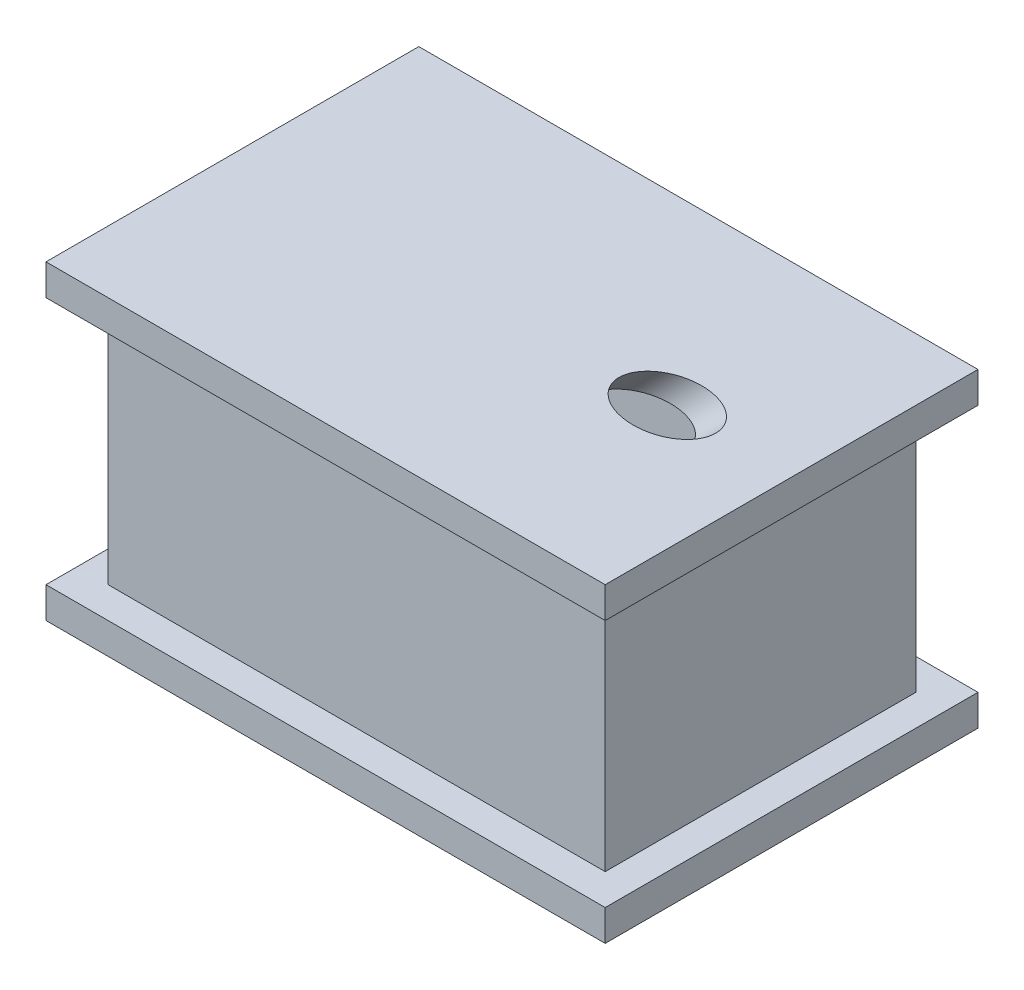
from build123d import *

# Parameters (mm, degrees)
SKETCH1_W           = 4000
SKETCH1_H           = 2500
SKETCH1_W_2         = 3500
SKETCH1_H_2         = 2000
BOSS_EXTRUDE2_DEPTH = 1000
SKETCH4_W           = 4500
SKETCH4_H           = 3000
BOSS_EXTRUDE3_DEPTH = 250
SKETCH7_R           = 275
CUT_EXTRUDE1_DEPTH  = 3746.831015943


with BuildPart() as part:
    # Sketch1 → Boss-Extrude2 (new, symmetric)
    with BuildSketch(Plane(origin=(0, 0, 0), x_dir=(1, 0, 0), z_dir=(0, 1, 0))):
        Rectangle(SKETCH1_W, SKETCH1_H)
        Rectangle(SKETCH1_W_2, SKETCH1_H_2, mode=Mode.SUBTRACT)
    extrude(amount=BOSS_EXTRUDE2_DEPTH, both=True)

    # Sketch4 → Boss-Extrude3 (add)
    with BuildSketch(Plane(origin=(0, 1000, 0), x_dir=(1, 0, 0), z_dir=(0, 1, 0))):
        Rectangle(SKETCH4_W, SKETCH4_H)
    boss_extrude3 = extrude(amount=BOSS_EXTRUDE3_DEPTH)

    # Mirror1: Boss-Extrude3 across plane
    add(boss_extrude3.mirror(Plane.ZX))

    # Sketch7 → Cut-Extrude1 (cut, through all)
    with BuildSketch(Plane(origin=(625, 625, 0), x_dir=(0.7071067811865477, -0.7071067811865475, 0), z_dir=(0.7071067811865475, 0.7071067811865477, 0))):
        with Locations(Location((0, 0, 0), (0, 0, 180))):
            Circle(SKETCH7_R)
    extrude(amount=CUT_EXTRUDE1_DEPTH, mode=Mode.SUBTRACT)


solid = part.part
